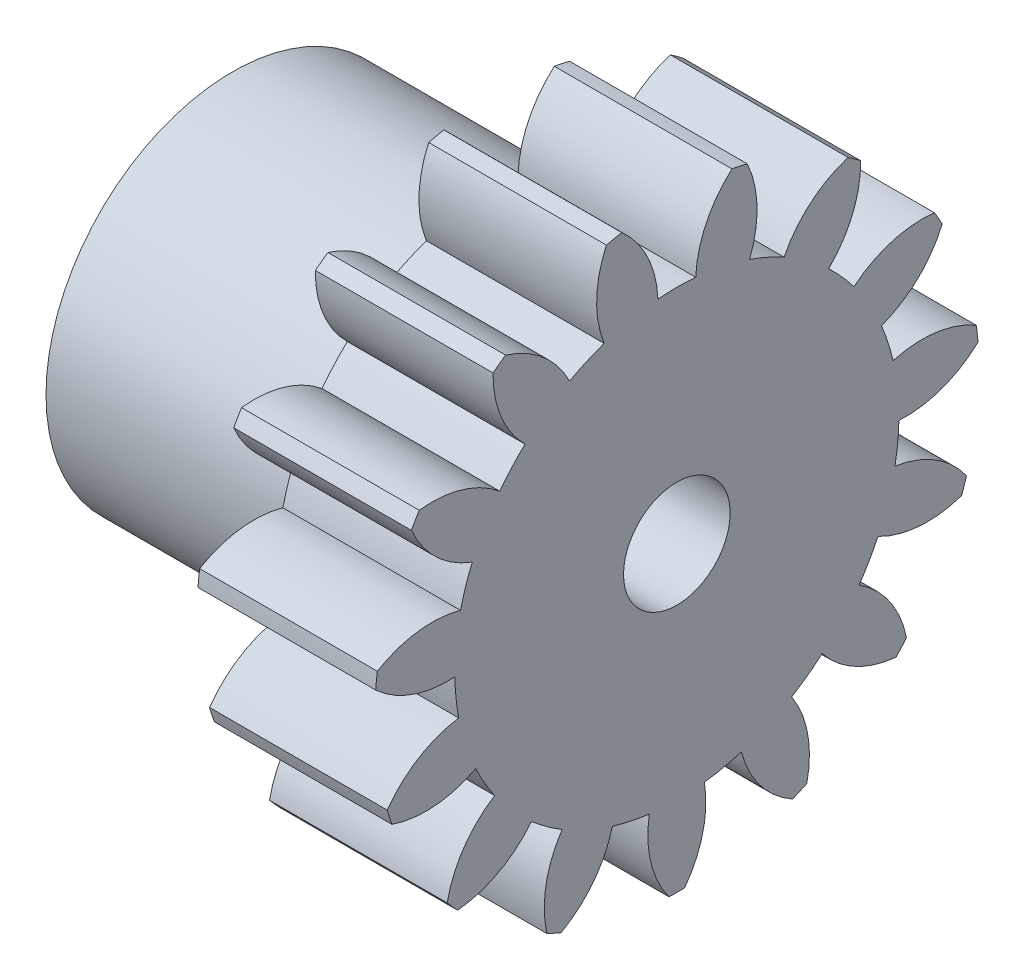
from build123d import *

# Parameters (mm, degrees)
BASPROSKE_W         = 5
BASPROSKE_H         = 8.5
TOOTHCUT_DEPTH      = 14.019216566
TEETHCUTS_COUNT     = 15
TEETHCUTS_ANGLE     = 336
BORSKE_R            = 1.5
BORE_DEPTH          = 50.0000508
SKETCH1_R           = 5.25
BOSS_EXTRUDE1_DEPTH = 7.5
FILLET1_R           = 0.5


with BuildPart() as part:
    # BasProSke → Base-Revolve (revolve)
    with BuildSketch(Plane(origin=(0, 0, 0), x_dir=(1, 0, 0), z_dir=(0, 1, 0)), mode=Mode.PRIVATE) as base_revolve_sk:
        with Locations((2.5, 4.25)):
            Rectangle(BASPROSKE_W, BASPROSKE_H)
    revolve(base_revolve_sk.sketch.rotate(Axis((-10, 0, 0), (1, 0, 0)), 180), axis=Axis((-10, 0, 0), (1, 0, 0)))

    # TooCutSke → ToothCut (cut, through all)
    with BuildSketch(Plane(origin=(0, 0, 0), x_dir=(0, 0, -1), z_dir=(1, 0, 0))):
        with BuildLine():
            ThreePointArc((0.531576138, 6.226349477), (0, 6.249), (-0.531576138, 6.226349477))
            ThreePointArc((-0.531576138, 6.226349477), (-0.830301624, 7.411024729), (-1.576608494, 8.378350125))
            ThreePointArc((-1.576608494, 8.378350125), (0, 8.5254), (1.576608494, 8.378350125))
            ThreePointArc((1.576608494, 8.378350125), (0.830301624, 7.411024729), (0.531576138, 6.226349477))
        make_face()
    toothcut = extrude(amount=TOOTHCUT_DEPTH, mode=Mode.SUBTRACT)

    # TeethCuts: ToothCut ×15 about axis
    teethcuts_axis = Axis((-10, 0, 0), (1, 0, 0))
    for i in range(1, TEETHCUTS_COUNT):
        add(toothcut.rotate(teethcuts_axis, i * TEETHCUTS_ANGLE / (TEETHCUTS_COUNT - 1)), mode=Mode.SUBTRACT)

    # BorSke → Bore (cut, symmetric)
    with BuildSketch(Plane(origin=(0, 0, 0), x_dir=(0, 0, -1), z_dir=(1, 0, 0))):
        with Locations(Location((0, 0, 0), (0, 0, 180))):
            Circle(BORSKE_R)
    extrude(amount=BORE_DEPTH, both=True, mode=Mode.SUBTRACT)

    # Sketch1 → Boss-Extrude1 (add)
    with BuildSketch(Plane.ZY):
        with Locations(Location((0, 0, 0), (0, 0, 180))):
            Circle(SKETCH1_R)
        Polygon((0.430653521, -2.737395091), (0.605495561, -2.863218586), (0.714430058, -2.677383804), (0.901466431, -2.784242054), (0.99037915, -2.588038539), (1.187560647, -2.674760784), (1.25547744, -2.470338183), (1.4606437, -2.535974275), (1.506820458, -2.325572284), (1.717723635, -2.369403101), (1.741654435, -2.155326929), (1.95598383, -2.176872251), (1.957406481, -1.961467361), (2.172813857, -1.960491133), (2.151712773, -1.746117546), (2.365838081, -1.722630464), (2.322444449, -1.511636902), (2.532941688, -1.465896295), (2.467730937, -1.260594447), (2.672293855, -1.19310146), (2.585980449, -0.995740657), (2.782367812, -0.907234755), (2.675897419, -0.719977323), (2.861957565, -0.611428197), (2.736496696, -0.436325766), (2.910191112, -0.308922703), (2.767114342, -0.147893734), (2.926539996, -0.003032587), (2.767414905, 0.142158653), (2.910825095, 0.302890754), (2.737395091, 0.430653521), (2.863218586, 0.605495561), (2.677383804, 0.714430058), (2.784242054, 0.901466431), (2.588038539, 0.99037915), (2.674760784, 1.187560647), (2.470338183, 1.25547744), (2.535974275, 1.4606437), (2.325572284, 1.506820458), (2.369403101, 1.717723635), (2.155326929, 1.741654435), (2.176872251, 1.95598383), (1.961467361, 1.957406481), (1.960491133, 2.172813857), (1.746117546, 2.151712773), (1.722630464, 2.365838081), (1.511636902, 2.322444449), (1.465896295, 2.532941688), (1.260594447, 2.467730937), (1.19310146, 2.672293855), (0.995740657, 2.585980449), (0.907234755, 2.782367812), (0.719977323, 2.675897419), (0.611428197, 2.861957565), (0.436325766, 2.736496696), (0.308922703, 2.910191112), (0.147893734, 2.767114342), (0.003032587, 2.926539996), (-0.142158653, 2.767414905), (-0.302890754, 2.910825095), (-0.430653521, 2.737395091), (-0.605495561, 2.863218586), (-0.714430058, 2.677383804), (-0.901466431, 2.784242054), (-0.99037915, 2.588038539), (-1.187560647, 2.674760784), (-1.25547744, 2.470338183), (-1.4606437, 2.535974275), (-1.506820458, 2.325572284), (-1.717723635, 2.369403101), (-1.741654435, 2.155326929), (-1.95598383, 2.176872251), (-1.957406481, 1.961467361), (-2.172813857, 1.960491133), (-2.151712773, 1.746117546), (-2.365838081, 1.722630464), (-2.322444449, 1.511636902), (-2.532941688, 1.465896295), (-2.467730937, 1.260594447), (-2.672293855, 1.19310146), (-2.585980449, 0.995740657), (-2.782367812, 0.907234755), (-2.675897419, 0.719977323), (-2.861957565, 0.611428197), (-2.736496696, 0.436325766), (-2.910191112, 0.308922703), (-2.767114342, 0.147893734), (-2.926539996, 0.003032587), (-2.767414905, -0.142158653), (-2.910825095, -0.302890754), (-2.737395091, -0.430653521), (-2.863218586, -0.605495561), (-2.677383804, -0.714430058), (-2.784242054, -0.901466431), (-2.588038539, -0.99037915), (-2.674760784, -1.187560647), (-2.470338183, -1.25547744), (-2.535974275, -1.4606437), (-2.325572284, -1.506820458), (-2.369403101, -1.717723635), (-2.155326929, -1.741654435), (-2.176872251, -1.95598383), (-1.961467361, -1.957406481), (-1.960491133, -2.172813857), (-1.746117546, -2.151712773), (-1.722630464, -2.365838081), (-1.511636902, -2.322444449), (-1.465896295, -2.532941688), (-1.260594447, -2.467730937), (-1.19310146, -2.672293855), (-0.995740657, -2.585980449), (-0.907234755, -2.782367812), (-0.719977323, -2.675897419), (-0.611428197, -2.861957565), (-0.436325766, -2.736496696), (-0.308922703, -2.910191112), (-0.147893734, -2.767114342), (-0.003032587, -2.926539996), (0.142158653, -2.767414905), (0.302890754, -2.910825095), align=None, mode=Mode.SUBTRACT)
    extrude(amount=BOSS_EXTRUDE1_DEPTH)

    # Fillet1
    fillet1_edges = [part.edges().sort_by_distance(p)[0] for p in [
        (0, 0, 5.25),
    ]]
    fillet(fillet1_edges, radius=FILLET1_R)


solid = part.part
